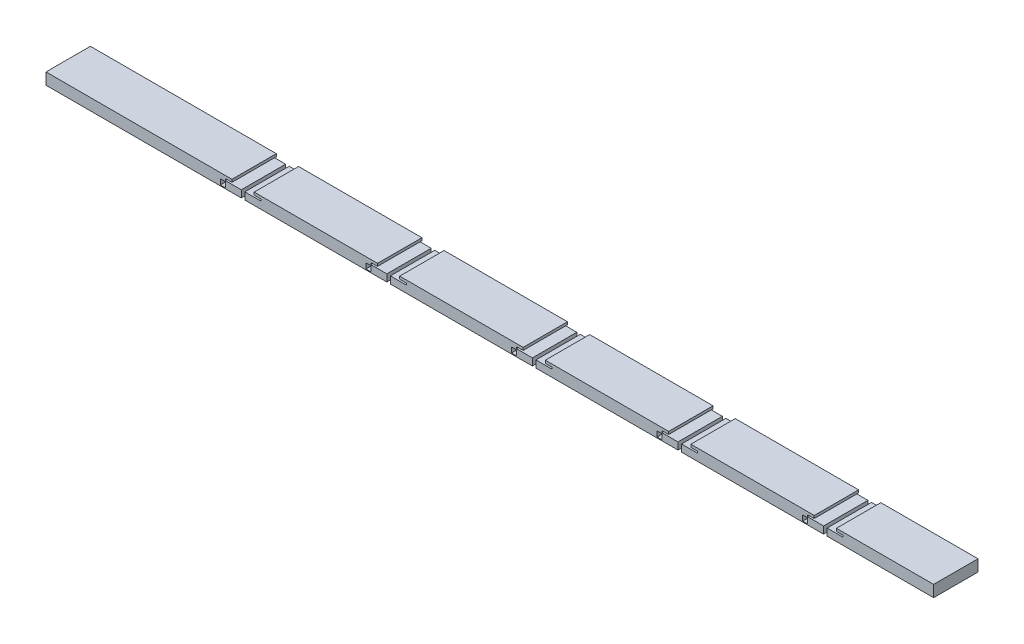
from build123d import *

# Parameters (mm, degrees)
SKETCH1_W             = 200
SKETCH1_H             = 10
BOSS_EXTRUDE1_DEPTH   = 2.6
SKETCH3_W             = 0.8
SKETCH3_H             = 10
CUT_EXTRUDE1_DEPTH    = 2
SKETCH4_W             = 5
SKETCH4_H             = 10
CUT_EXTRUDE2_DEPTH    = 0.6
SKETCH5_W             = 5
SKETCH5_H             = 10
BOSS_EXTRUDE2_DEPTH   = 0.6
BOSS_EXTRUDE2_2_DEPTH = 0.6
BOSS_EXTRUDE2_3_DEPTH = 0.6
BOSS_EXTRUDE2_4_DEPTH = 0.6
BOSS_EXTRUDE2_5_DEPTH = 0.6
SKETCH6_W             = 3.6
SKETCH6_H             = 10
CUT_EXTRUDE3_DEPTH    = 0.4
SKETCH11_W            = 1.1
SKETCH11_H            = 1.2
CUT_EXTRUDE4_DEPTH    = 5
SKETCH12_W            = 5
SKETCH12_H            = 10
CUT_EXTRUDE6_DEPTH    = 0.6


with BuildPart() as part:
    # Sketch1 → Boss-Extrude1 (new body)
    with BuildSketch(Plane(origin=(0, 0, 0), x_dir=(1, 0, 0), z_dir=(0, 1, 0))):
        with Locations((78.695652174, -3.217391304)):
            Rectangle(SKETCH1_W, SKETCH1_H)
    extrude(amount=BOSS_EXTRUDE1_DEPTH)

    # Sketch3 → Cut-Extrude1 (cut)
    with BuildSketch(Plane.XZ):
        with Locations((23.095652174, 3.217391304)):
            Rectangle(SKETCH3_W, SKETCH3_H)
        with Locations((55.895652174, 3.217391304)):
            Rectangle(SKETCH3_W, SKETCH3_H)
        with Locations((88.695652174, 3.217391304)):
            Rectangle(SKETCH3_W, SKETCH3_H)
        with Locations((121.495652174, 3.217391304)):
            Rectangle(SKETCH3_W, SKETCH3_H)
        with Locations((154.295652174, 3.217391304)):
            Rectangle(SKETCH3_W, SKETCH3_H)
    extrude(amount=-CUT_EXTRUDE1_DEPTH, mode=Mode.SUBTRACT)

    # Sketch4 → Cut-Extrude2 (cut)
    with BuildSketch(Plane(origin=(0, 2.6, 0), x_dir=(1, 0, 0), z_dir=(0, 1, 0))):
        with Locations((154.295652174, -3.217391304)):
            Rectangle(SKETCH4_W, SKETCH4_H)
        with Locations((121.495652174, -3.217391304)):
            Rectangle(SKETCH4_W, SKETCH4_H)
        with Locations((88.695652174, -3.217391304)):
            Rectangle(SKETCH4_W, SKETCH4_H)
        with Locations((55.895652174, -3.217391304)):
            Rectangle(SKETCH4_W, SKETCH4_H)
        with Locations((23.095652174, -3.217391304)):
            Rectangle(SKETCH4_W, SKETCH4_H)
    extrude(amount=-CUT_EXTRUDE2_DEPTH, mode=Mode.SUBTRACT)


with BuildPart() as cut_extrude2_piece_1:
    # of the separate pieces the step leaves, piece 1, a body of its own (cut_extrude2_pieces)
    add(part.part.solids().sort_by_distance((-21.304347826, 0, 8.217391304))[0])


with BuildPart() as cut_extrude2_piece_2:
    # of the separate pieces the step leaves, piece 2, a body of its own (cut_extrude2_pieces)
    add(part.part.solids().sort_by_distance((91.195652174, 2.6, 8.217391304))[0])


with BuildPart() as cut_extrude2_piece_3:
    # of the separate pieces the step leaves, piece 3, a body of its own (cut_extrude2_pieces)
    add(part.part.solids().sort_by_distance((23.495652174, 0, 8.217391304))[0])


with BuildPart() as cut_extrude2_piece_4:
    # of the separate pieces the step leaves, piece 4, a body of its own (cut_extrude2_pieces)
    add(part.part.solids().sort_by_distance((58.395652174, 2.6, 8.217391304))[0])


with BuildPart() as cut_extrude2_piece_5:
    # of the separate pieces the step leaves, piece 5, a body of its own (cut_extrude2_pieces)
    add(part.part.solids().sort_by_distance((123.995652174, 2.6, 8.217391304))[0])


with BuildPart() as cut_extrude2_piece_6:
    # of the separate pieces the step leaves, piece 6, a body of its own (cut_extrude2_pieces)
    add(part.part.solids().sort_by_distance((156.795652174, 2.6, 8.217391304))[0])


with BuildPart() as body_7:
    # Sketch5 → Boss-Extrude2 (new body)
    with BuildSketch(Plane(origin=(0, 2, 0), x_dir=(1, 0, 0), z_dir=(0, 1, 0))):
        with Locations((88.695652174, -3.217391304)):
            Rectangle(SKETCH5_W, SKETCH5_H)
    extrude(amount=BOSS_EXTRUDE2_DEPTH)


with BuildPart() as body_8:
    # Sketch5 → Boss-Extrude2 2 (new body)
    with BuildSketch(Plane(origin=(0, 2, 0), x_dir=(1, 0, 0), z_dir=(0, 1, 0))):
        with Locations((121.495652174, -3.217391304)):
            Rectangle(SKETCH5_W, SKETCH5_H)
    extrude(amount=BOSS_EXTRUDE2_2_DEPTH)


with BuildPart() as body_9:
    # Sketch5 → Boss-Extrude2 3 (new body)
    with BuildSketch(Plane(origin=(0, 2, 0), x_dir=(1, 0, 0), z_dir=(0, 1, 0))):
        with Locations((154.295652174, -3.217391304)):
            Rectangle(SKETCH5_W, SKETCH5_H)
    extrude(amount=BOSS_EXTRUDE2_3_DEPTH)


with BuildPart() as body_10:
    # Sketch5 → Boss-Extrude2 4 (new body)
    with BuildSketch(Plane(origin=(0, 2, 0), x_dir=(1, 0, 0), z_dir=(0, 1, 0))):
        with Locations((55.895652174, -3.217391304)):
            Rectangle(SKETCH5_W, SKETCH5_H)
    extrude(amount=BOSS_EXTRUDE2_4_DEPTH)


with BuildPart() as body_11:
    # Sketch5 → Boss-Extrude2 5 (new body)
    with BuildSketch(Plane(origin=(0, 2, 0), x_dir=(1, 0, 0), z_dir=(0, 1, 0))):
        with Locations((23.095652174, -3.217391304)):
            Rectangle(SKETCH5_W, SKETCH5_H)
    extrude(amount=BOSS_EXTRUDE2_5_DEPTH)


with BuildPart() as cut_extrude3_tool:
    # Sketch6 → Cut-Extrude3 (new body)
    with BuildSketch(Plane(origin=(0, 2, 0), x_dir=(1, 0, 0), z_dir=(0, 1, 0))):
        with Locations((156.495652174, -3.217391304)):
            Rectangle(SKETCH6_W, SKETCH6_H)
        with Locations((25.295652174, -3.217391304)):
            Rectangle(SKETCH6_W, SKETCH6_H)
        with Locations((152.095652174, -3.217391304)):
            Rectangle(SKETCH6_W, SKETCH6_H)
        with Locations((123.695652174, -3.217391304)):
            Rectangle(SKETCH6_W, SKETCH6_H)
        with Locations((119.295652174, -3.217391304)):
            Rectangle(SKETCH6_W, SKETCH6_H)
        with Locations((90.895652174, -3.217391304)):
            Rectangle(SKETCH6_W, SKETCH6_H)
        with Locations((86.495652174, -3.217391304)):
            Rectangle(SKETCH6_W, SKETCH6_H)
        with Locations((58.095652174, -3.217391304)):
            Rectangle(SKETCH6_W, SKETCH6_H)
        with Locations((53.695652174, -3.217391304)):
            Rectangle(SKETCH6_W, SKETCH6_H)
        with Locations((20.895652174, -3.217391304)):
            Rectangle(SKETCH6_W, SKETCH6_H)
    extrude(amount=-CUT_EXTRUDE3_DEPTH)


with BuildPart() as cut_extrude2_piece_1_1:
    add(cut_extrude2_piece_1.part)

    # Cut-Extrude3: cut by cut_extrude3_tool
    add(cut_extrude3_tool.part, mode=Mode.SUBTRACT)


with BuildPart() as cut_extrude2_piece_2_1:
    add(cut_extrude2_piece_2.part)

    # Cut-Extrude3: cut by cut_extrude3_tool
    add(cut_extrude3_tool.part, mode=Mode.SUBTRACT)


with BuildPart() as cut_extrude2_piece_3_1:
    add(cut_extrude2_piece_3.part)

    # Cut-Extrude3: cut by cut_extrude3_tool
    add(cut_extrude3_tool.part, mode=Mode.SUBTRACT)


with BuildPart() as cut_extrude2_piece_4_1:
    add(cut_extrude2_piece_4.part)

    # Cut-Extrude3: cut by cut_extrude3_tool
    add(cut_extrude3_tool.part, mode=Mode.SUBTRACT)


with BuildPart() as cut_extrude2_piece_5_1:
    add(cut_extrude2_piece_5.part)

    # Cut-Extrude3: cut by cut_extrude3_tool
    add(cut_extrude3_tool.part, mode=Mode.SUBTRACT)


with BuildPart() as cut_extrude2_piece_6_1:
    add(cut_extrude2_piece_6.part)

    # Cut-Extrude3: cut by cut_extrude3_tool
    add(cut_extrude3_tool.part, mode=Mode.SUBTRACT)


with BuildPart() as cut_extrude4_tool:
    # Sketch11 → Cut-Extrude4 (new body)
    with BuildSketch(Plane.XY.offset(8.217391304)):
        with Locations((18.545652174, 0.8)):
            Rectangle(SKETCH11_W, SKETCH11_H)
        with Locations((51.345652174, 0.8)):
            Rectangle(SKETCH11_W, SKETCH11_H)
        with Locations((84.145652174, 0.8)):
            Rectangle(SKETCH11_W, SKETCH11_H)
        with Locations((116.945652174, 0.8)):
            Rectangle(SKETCH11_W, SKETCH11_H)
        with Locations((149.745652174, 0.8)):
            Rectangle(SKETCH11_W, SKETCH11_H)
    extrude(amount=-CUT_EXTRUDE4_DEPTH)


with BuildPart() as cut_extrude2_piece_1_2:
    add(cut_extrude2_piece_1_1.part)

    # Cut-Extrude4: cut by cut_extrude4_tool
    add(cut_extrude4_tool.part, mode=Mode.SUBTRACT)


with BuildPart() as cut_extrude2_piece_2_2:
    add(cut_extrude2_piece_2_1.part)

    # Cut-Extrude4: cut by cut_extrude4_tool
    add(cut_extrude4_tool.part, mode=Mode.SUBTRACT)


with BuildPart() as cut_extrude2_piece_3_2:
    add(cut_extrude2_piece_3_1.part)

    # Cut-Extrude4: cut by cut_extrude4_tool
    add(cut_extrude4_tool.part, mode=Mode.SUBTRACT)


with BuildPart() as cut_extrude2_piece_4_2:
    add(cut_extrude2_piece_4_1.part)

    # Cut-Extrude4: cut by cut_extrude4_tool
    add(cut_extrude4_tool.part, mode=Mode.SUBTRACT)


with BuildPart() as cut_extrude2_piece_5_2:
    add(cut_extrude2_piece_5_1.part)

    # Cut-Extrude4: cut by cut_extrude4_tool
    add(cut_extrude4_tool.part, mode=Mode.SUBTRACT)


with BuildPart() as cut_extrude6_tool:
    # Sketch12 → Cut-Extrude6 (new body)
    with BuildSketch(Plane(origin=(0, 2.6, 0), x_dir=(1, 0, 0), z_dir=(0, 1, 0))):
        with Locations((23.095652174, -3.217391304)):
            Rectangle(SKETCH12_W, SKETCH12_H)
        with Locations((55.895652174, -3.217391304)):
            Rectangle(SKETCH12_W, SKETCH12_H)
        with Locations((88.695652174, -3.217391304)):
            Rectangle(SKETCH12_W, SKETCH12_H)
        with Locations((121.495652174, -3.217391304)):
            Rectangle(SKETCH12_W, SKETCH12_H)
        with Locations((154.295652174, -3.217391304)):
            Rectangle(SKETCH12_W, SKETCH12_H)
    extrude(amount=-CUT_EXTRUDE6_DEPTH)


with BuildPart() as body_7_1:
    add(body_7.part)

    # Cut-Extrude6: cut by cut_extrude6_tool
    add(cut_extrude6_tool.part, mode=Mode.SUBTRACT)


with BuildPart() as body_8_1:
    add(body_8.part)

    # Cut-Extrude6: cut by cut_extrude6_tool
    add(cut_extrude6_tool.part, mode=Mode.SUBTRACT)


with BuildPart() as body_9_1:
    add(body_9.part)

    # Cut-Extrude6: cut by cut_extrude6_tool
    add(cut_extrude6_tool.part, mode=Mode.SUBTRACT)


with BuildPart() as body_10_1:
    add(body_10.part)

    # Cut-Extrude6: cut by cut_extrude6_tool
    add(cut_extrude6_tool.part, mode=Mode.SUBTRACT)


with BuildPart() as body_11_1:
    add(body_11.part)

    # Cut-Extrude6: cut by cut_extrude6_tool
    add(cut_extrude6_tool.part, mode=Mode.SUBTRACT)


solid = Compound([cut_extrude2_piece_6_1.part, cut_extrude2_piece_1_2.part, cut_extrude2_piece_2_2.part, cut_extrude2_piece_3_2.part, cut_extrude2_piece_4_2.part, cut_extrude2_piece_5_2.part])
